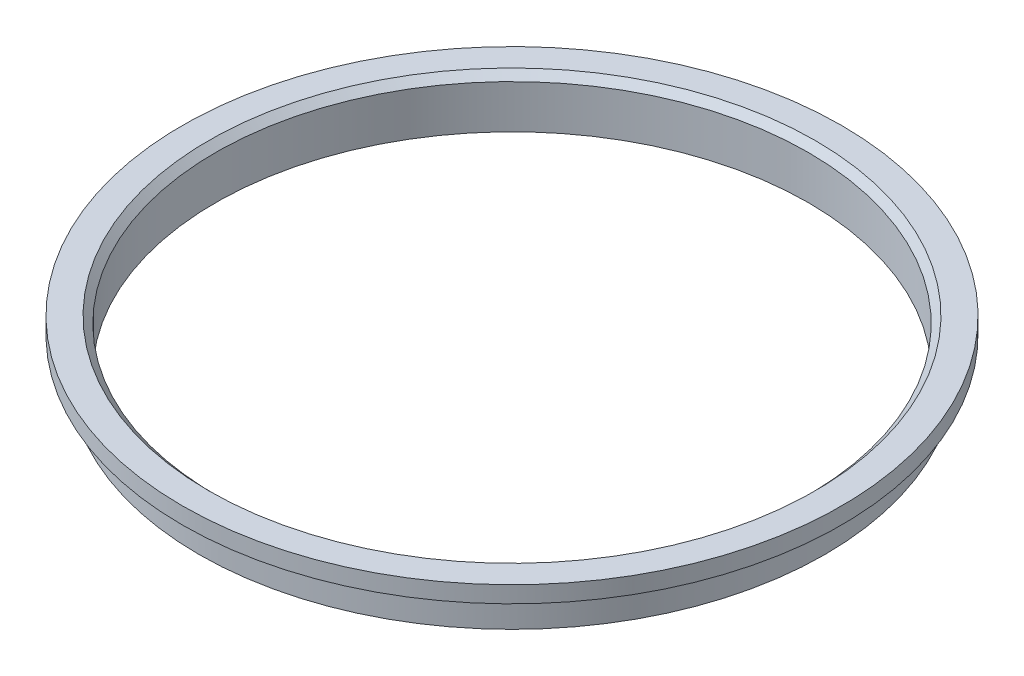
from build123d import *

# Parameters (mm, degrees)
CHAMFER1_SIZE = 1.27
FILLET1_R     = 1.5875


with BuildPart() as part:
    # Sketch1 → Revolve1 (revolve)
    with BuildSketch(Plane.XY, mode=Mode.PRIVATE) as revolve1_sk:
        Polygon((-54.5465, 0), (-54.5465, -9.271), (-57.5945, -9.271), (-57.5945, -3.048), (-60.6425, -3.048), (-60.6425, 0), align=None)
    revolve(revolve1_sk.sketch.rotate(Axis((0, 0, 0), (0, 1, 0)), 270), axis=Axis((0, 0, 0), (0, 1, 0)))

    # Chamfer1
    chamfer1_edges = [part.edges().sort_by_distance(p)[0] for p in [
        (0, 0, 54.5465),
    ]]
    chamfer(chamfer1_edges, length=CHAMFER1_SIZE)

    # Fillet1
    fillet1_edges = [part.edges().sort_by_distance(p)[0] for p in [
        (0, -3.048, 57.5945),
    ]]
    fillet(fillet1_edges, radius=FILLET1_R)


solid = part.part
